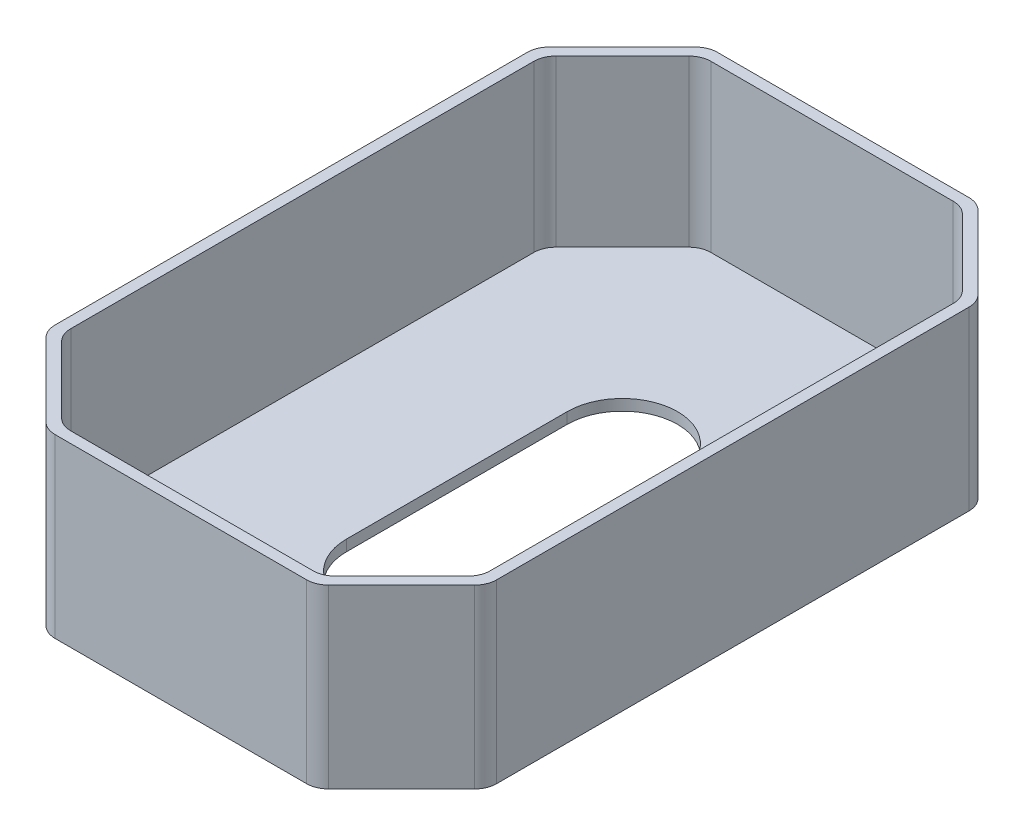
from build123d import *

# Parameters (mm, degrees)
BOSS_EXTRUDE1_DEPTH = 6.35
BOSS_EXTRUDE2_DEPTH = 101.6
FILLET1_R           = 12.7
FILLET2_R           = 12.7


with BuildPart() as part:
    # Sketch1 → Boss-Extrude1 (new body)
    with BuildSketch(Plane(origin=(0, 0, 0), x_dir=(1, 0, 0), z_dir=(0, 1, 0))):
        Polygon((-77.608591334, 190.5), (-127, 141.108591334), (-127, -141.108591334), (-77.608591334, -190.5), (77.608591334, -190.5), (127, -141.108591334), (127, 141.108591334), (77.608591334, 190.5), align=None)
        with BuildLine():
            Line((-31.75, -63.5), (-31.75, 63.5))
            ThreePointArc((-31.75, 63.5), (0, 95.25), (31.75, 63.5))
            Line((31.75, 63.5), (31.75, -63.5))
            ThreePointArc((31.75, -63.5), (0, -95.25), (-31.75, -63.5))
        make_face(mode=Mode.SUBTRACT)
    extrude(amount=BOSS_EXTRUDE1_DEPTH)

    # Sketch1<4> → Boss-Extrude2 (add)
    with BuildSketch(Plane(origin=(0, 0, 0), x_dir=(1, 0, 0), z_dir=(0, 1, 0))):
        Polygon((-77.608591334, 190.5), (-127, 141.108591334), (-127, -141.108591334), (-77.608591334, -190.5), (77.608591334, -190.5), (127, -141.108591334), (127, 141.108591334), (77.608591334, 190.5), align=None)
        Polygon((-120.65, 138.478335213), (-74.978335213, 184.15), (74.978335213, 184.15), (120.65, 138.478335213), (120.65, -138.478335213), (74.978335213, -184.15), (-74.978335213, -184.15), (-120.65, -138.478335213), align=None, mode=Mode.SUBTRACT)
    extrude(amount=BOSS_EXTRUDE2_DEPTH)

    # Fillet1
    fillet1_edges = [part.edges().sort_by_distance(p)[0] for p in [
        (77.608591334, 50.8, 190.5),
        (127, 50.8, 141.108591334),
        (-77.608591334, 50.8, 190.5),
        (-127, 50.8, 141.108591334),
        (-127, 50.8, -141.108591334),
        (-77.608591334, 50.8, -190.5),
        (127, 50.8, -141.108591334),
        (77.608591334, 50.8, -190.5),
    ]]
    fillet(fillet1_edges, radius=FILLET1_R)

    # Fillet2
    fillet2_edges = [part.edges().sort_by_distance(p)[0] for p in [
        (74.978335213, 53.975, 184.15),
        (120.65, 53.975, 138.478335213),
        (-74.978335213, 53.975, 184.15),
        (-120.65, 53.975, 138.478335213),
        (-120.65, 53.975, -138.478335213),
        (120.65, 53.975, -138.478335213),
        (74.978335213, 53.975, -184.15),
        (-74.978335213, 53.975, -184.15),
    ]]
    fillet(fillet2_edges, radius=FILLET2_R)


solid = part.part
